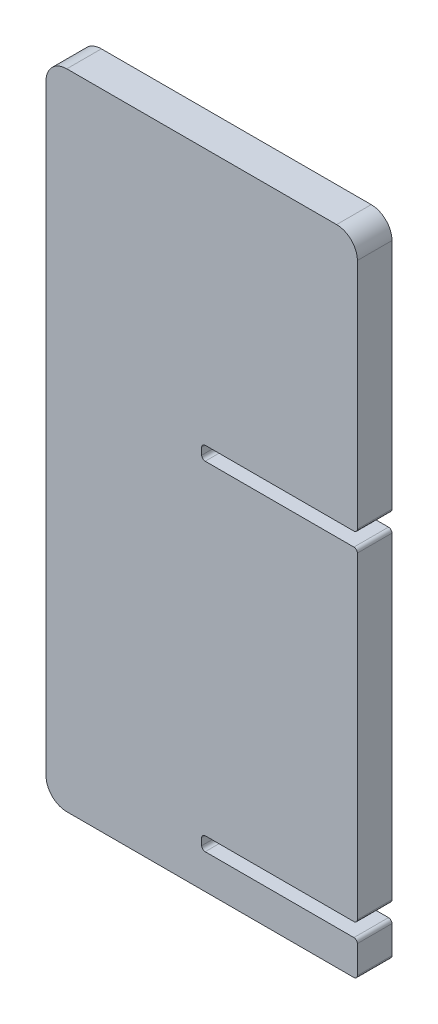
from build123d import *

# Parameters (mm, degrees)
CROQUIS1_W              = 45
CROQUIS1_H              = 93
SALIENTE_EXTRUIR1_DEPTH = 5
CROQUIS2_W              = 22.5
CROQUIS2_H              = 2
CORTAR_EXTRUIR1_DEPTH   = 5
CROQUIS3_W              = 22.5
CROQUIS3_H              = 2
CORTAR_EXTRUIR2_DEPTH   = 5
REDONDEO1_R             = 3
REDONDEO2_R             = 0.5


with BuildPart() as part:
    # Croquis1 → Saliente-Extruir1 (new body)
    with BuildSketch(Plane.XY):
        with Locations((0, -1.5)):
            Rectangle(CROQUIS1_W, CROQUIS1_H)
    extrude(amount=SALIENTE_EXTRUIR1_DEPTH)

    # Croquis2 → Cortar-Extruir1 (cut)
    with BuildSketch(Plane.XY.offset(5)):
        with Locations((11.25, 6.879451896)):
            Rectangle(CROQUIS2_W, CROQUIS2_H)
    extrude(amount=-CORTAR_EXTRUIR1_DEPTH, mode=Mode.SUBTRACT)

    # Croquis3 → Cortar-Extruir2 (cut)
    with BuildSketch(Plane.XY.offset(5)):
        with Locations((11.25, -42)):
            Rectangle(CROQUIS3_W, CROQUIS3_H)
    extrude(amount=-CORTAR_EXTRUIR2_DEPTH, mode=Mode.SUBTRACT)

    # Redondeo1
    redondeo1_edges = [part.edges().sort_by_distance(p)[0] for p in [
        (-22.5, 45, 2.5),
        (-22.5, -48, 2.5),
        (22.5, 45, 2.5),
    ]]
    fillet(redondeo1_edges, radius=REDONDEO1_R)

    # Redondeo2
    redondeo2_edges = [part.edges().sort_by_distance(p)[0] for p in [
        (0, 7.879451896, 2.5),
        (0, 5.879451896, 2.5),
        (22.5, 5.879451896, 2.5),
        (22.5, 7.879451896, 2.5),
        (0, -41, 2.5),
        (0, -43, 2.5),
        (22.5, -43, 2.5),
        (22.5, -41, 2.5),
        (22.5, -48, 2.5),
    ]]
    fillet(redondeo2_edges, radius=REDONDEO2_R)


solid = part.part
